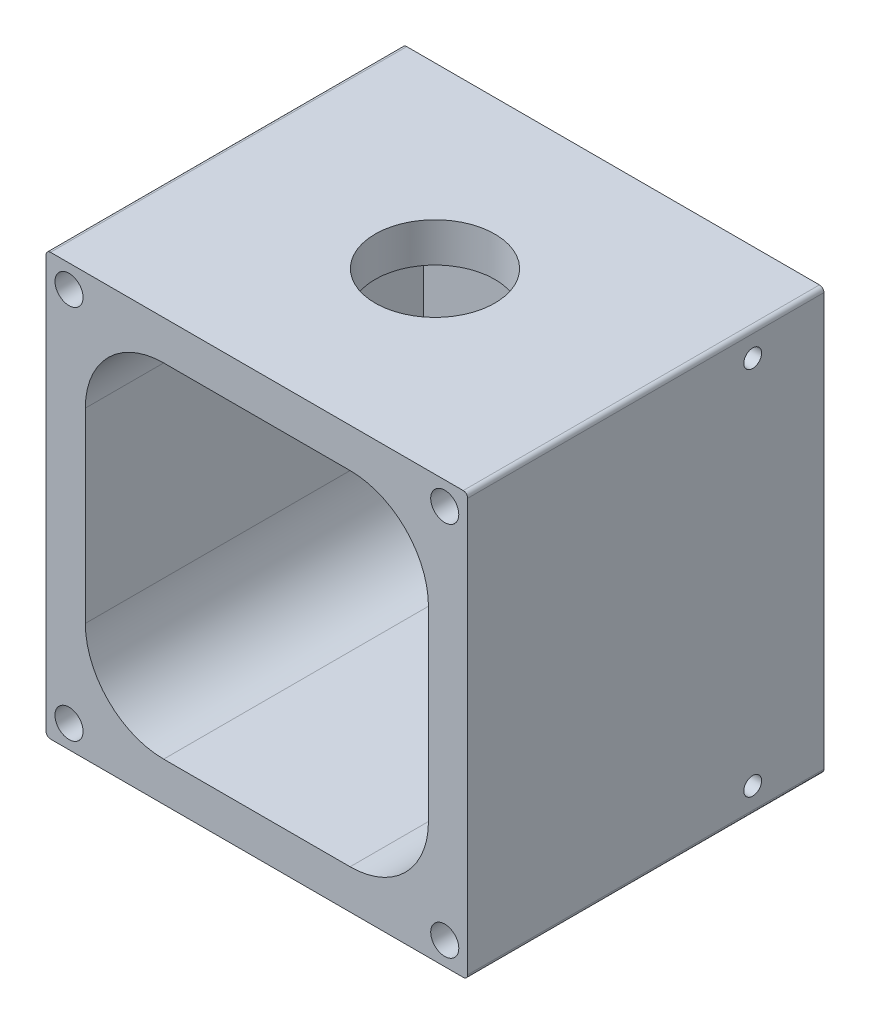
from build123d import *

# Parameters (mm, degrees)
BOSS_EXTRUDE1_DEPTH = 63.5
SKETCH10_R          = 2.5019
CUT_EXTRUDE3_DEPTH  = 12.7
BOSS_EXTRUDE2_START = -60.325
SKETCH12_R          = 12.5
BOSS_EXTRUDE2_DEPTH = 3.175
SKETCH14_R          = 1.5875
CUT_EXTRUDE4_DEPTH  = 6.35
CUT_EXTRUDE5_REACH  = 107.322
SKETCH15_R          = 10.668


with BuildPart() as part:
    # Sketch1 → Boss-Extrude1 (new body)
    with BuildSketch(Plane.XY):
        with BuildLine():
            Line((37.577733998, 36.783983953), (37.577733998, -36.783983998))
            ThreePointArc((37.577733998, -36.783983998), (37.345250005, -37.345250005), (36.783983998, -37.577733998))
            Line((36.783983998, -37.577733998), (-36.783983953, -37.577733998))
            ThreePointArc((-36.783983953, -37.577733998), (-37.34524996, -37.345250005), (-37.577733953, -36.783983998))
            Line((-37.577733953, -36.783983998), (-37.577733953, 36.783983953))
            ThreePointArc((-37.577733953, 36.783983953), (-37.34524996, 37.34524996), (-36.783983953, 37.577733953))
            Line((-36.783983953, 37.577733953), (36.783983998, 37.577733953))
            ThreePointArc((36.783983998, 37.577733953), (37.345250005, 37.34524996), (37.577733998, 36.783983953))
        make_face()
        with BuildLine():
            Line((-16.61571496, 30.582545515), (16.61571496, 30.582545515))
            ThreePointArc((16.61571496, 30.582545515), (26.491755557, 26.491755557), (30.582545515, 16.61571496))
            Line((30.582545515, 16.61571496), (30.582545515, -16.61571496))
            ThreePointArc((30.582545515, -16.61571496), (26.491755557, -26.491755557), (16.61571496, -30.582545515))
            Line((16.61571496, -30.582545515), (-16.61571496, -30.582545515))
            ThreePointArc((-16.61571496, -30.582545515), (-26.491755557, -26.491755557), (-30.582545515, -16.61571496))
            Line((-30.582545515, -16.61571496), (-30.582545515, 16.61571496))
            ThreePointArc((-30.582545515, 16.61571496), (-26.491755557, 26.491755557), (-16.61571496, 30.582545515))
        make_face(mode=Mode.SUBTRACT)
    extrude(amount=-BOSS_EXTRUDE1_DEPTH)

    # Sketch10 → Cut-Extrude3 (cut)
    with BuildSketch(Plane.XY):
        with Locations((33.488333998, 33.488333998)):
            Circle(SKETCH10_R)
        with Locations((33.488333998, -33.488333998)):
            Circle(SKETCH10_R)
        with Locations((-33.488333998, -33.488333998)):
            Circle(SKETCH10_R)
        with Locations((-33.488333998, 33.488333998)):
            Circle(SKETCH10_R)
    extrude(amount=-CUT_EXTRUDE3_DEPTH, mode=Mode.SUBTRACT)

    # Sketch12 → Boss-Extrude2 (add)
    with BuildSketch(Plane.XY.offset(BOSS_EXTRUDE2_START)):
        with BuildLine():
            Line((37.577733998, 36.783983953), (37.577733998, -36.783983998))
            ThreePointArc((37.577733998, -36.783983998), (37.345250005, -37.345250005), (36.783983998, -37.577733998))
            Line((36.783983998, -37.577733998), (-36.783983953, -37.577733998))
            ThreePointArc((-36.783983953, -37.577733998), (-37.34524996, -37.345250005), (-37.577733953, -36.783983998))
            Line((-37.577733953, -36.783983998), (-37.577733953, 36.783983953))
            ThreePointArc((-37.577733953, 36.783983953), (-37.34524996, 37.34524996), (-36.783983953, 37.577733953))
            Line((-36.783983953, 37.577733953), (36.783983998, 37.577733953))
            ThreePointArc((36.783983998, 37.577733953), (37.345250005, 37.34524996), (37.577733998, 36.783983953))
        make_face()
        Circle(SKETCH12_R, mode=Mode.SUBTRACT)
    extrude(amount=-BOSS_EXTRUDE2_DEPTH)

    # Sketch14 → Cut-Extrude4 (cut)
    with BuildSketch(Plane(origin=(37.577733998, 0, 0), x_dir=(0, 0, -1), z_dir=(1, 0, 0))):
        with Locations(Location((50.8, 33.005733953, 0), (0, 0, 90))):
            Circle(SKETCH14_R)
        with Locations(Location((50.8, -33.005733998, 0), (0, 0, 90))):
            Circle(SKETCH14_R)
    extrude(amount=-CUT_EXTRUDE4_DEPTH, mode=Mode.SUBTRACT)

    # Sketch15 → Cut-Extrude5 (cut, up to next)
    with BuildSketch(Plane.XZ.offset(-37.577733953), mode=Mode.PRIVATE) as cut_extrude5_sk1:
        with Locations(Location((0, -31.75, 0), (0, 0, 180))):
            Circle(SKETCH15_R)
    cut_extrude5_tool1 = extrude(cut_extrude5_sk1.sketch, amount=CUT_EXTRUDE5_REACH, mode=Mode.PRIVATE) & part.part
    add(cut_extrude5_tool1.solids().sort_by_distance((0, 37.577734, -31.75))[0], mode=Mode.SUBTRACT)


solid = part.part
